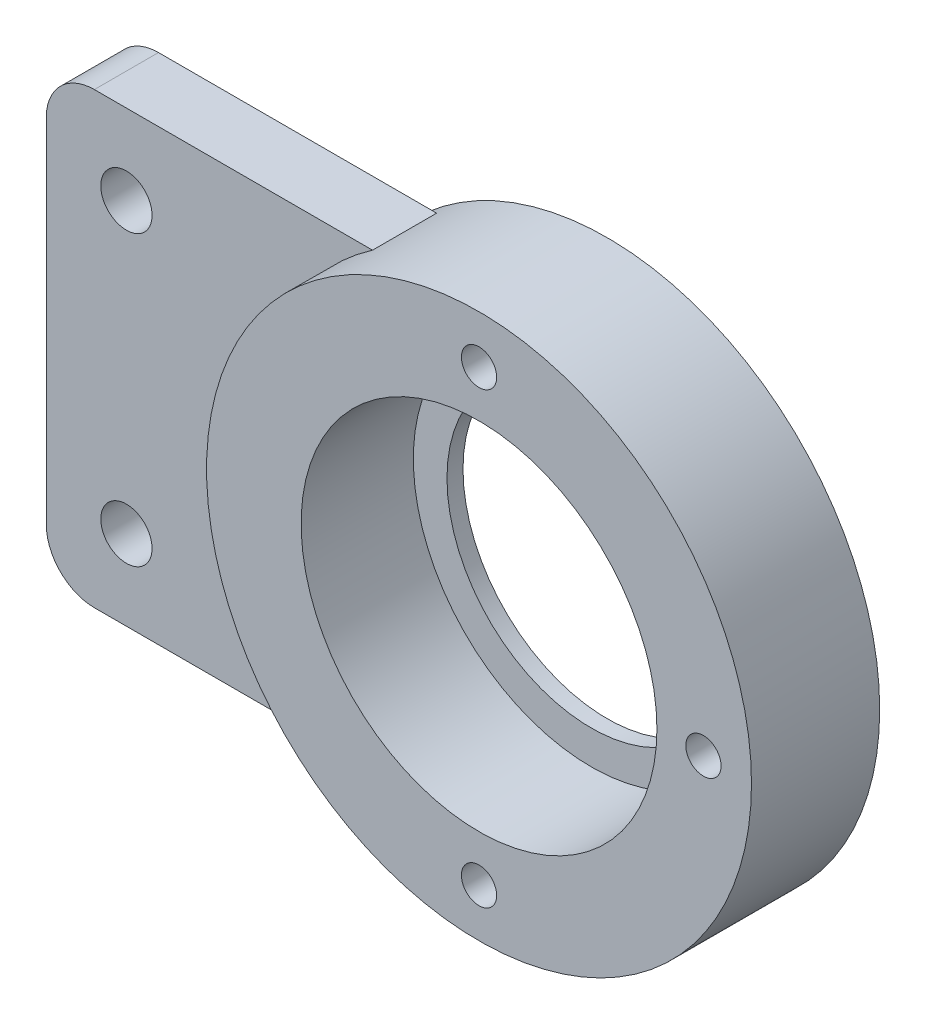
from build123d import *

# Parameters (mm, degrees)
BEARING_HOUSING_PROFILE_R                  = 17
BEARING_HOUSING_PROFILE_R_2                = 11.1
BEARING_HOUSING_DEPTH                      = 7
MOUNTING_WEB_PROFILE_W                     = 30
MOUNTING_WEB_PROFILE_H                     = 28
MOUNTING_WEB_DEPTH                         = 4
BEARING_SEAT_START                         = -50
BEARING_SEAT_PROFILE_R                     = 11.1
BEARING_SEAT_DEPTH                         = 86.185224172
INNER_OUTER_RACE_RETAINING_LIP_START       = -1
INNER_OUTER_RACE_RETAINING_LIP_PROFILE_R   = 17
INNER_OUTER_RACE_RETAINING_LIP_PROFILE_R_2 = 9
INNER_OUTER_RACE_RETAINING_LIP_DEPTH       = 1
STANDOFF_FASTENERS_START                   = -50
STANDOFF_FASTENERS_PROFILE_R               = 1.6
STANDOFF_FASTENERS_DEPTH                   = 86.185224172
BEARING_KEEPER_FASTENERS_START             = -50
BEARING_KEEPER_FASTENERS_PROFILE_R         = 1.1
BEARING_KEEPER_FASTENERS_DEPTH             = 86.185224172
FILLET1_R                                  = 3


with BuildPart() as part:
    # Bearing_housing_profile → Bearing_housing (new body)
    with BuildSketch(Plane.XY):
        Circle(BEARING_HOUSING_PROFILE_R)
        Circle(BEARING_HOUSING_PROFILE_R_2, mode=Mode.SUBTRACT)
    extrude(amount=BEARING_HOUSING_DEPTH)

    # Mounting_web_profile → Mounting_web (add)
    with BuildSketch(Plane.XY):
        with Locations((-15, 0)):
            Rectangle(MOUNTING_WEB_PROFILE_W, MOUNTING_WEB_PROFILE_H)
    extrude(amount=MOUNTING_WEB_DEPTH)

    # Bearing_seat_profile → Bearing_seat (cut, through all)
    with BuildSketch(Plane.XY.offset(BEARING_SEAT_START)):
        Circle(BEARING_SEAT_PROFILE_R)
    extrude(amount=BEARING_SEAT_DEPTH, mode=Mode.SUBTRACT)

    # Inner_outer_race_retaining_lip_profile → Inner_outer_race_retaining_lip (add)
    with BuildSketch(Plane.XY.offset(INNER_OUTER_RACE_RETAINING_LIP_START)):
        Circle(INNER_OUTER_RACE_RETAINING_LIP_PROFILE_R)
        Circle(INNER_OUTER_RACE_RETAINING_LIP_PROFILE_R_2, mode=Mode.SUBTRACT)
    extrude(amount=INNER_OUTER_RACE_RETAINING_LIP_DEPTH)

    # Standoff_fasteners_profile → Standoff_fasteners (cut, through all)
    with BuildSketch(Plane.XY.offset(STANDOFF_FASTENERS_START)):
        with Locations(Location((-25, -9, 0), (0, 0, 180))):
            Circle(STANDOFF_FASTENERS_PROFILE_R)
        with Locations(Location((-25, 9, 0), (0, 0, 180))):
            Circle(STANDOFF_FASTENERS_PROFILE_R)
    extrude(amount=STANDOFF_FASTENERS_DEPTH, mode=Mode.SUBTRACT)

    # Bearing_keeper_fasteners_profile → Bearing_keeper_fasteners (cut, through all)
    with BuildSketch(Plane.XY.offset(BEARING_KEEPER_FASTENERS_START)):
        with Locations(Location((14, 0, 0), (0, 0, 180))):
            Circle(BEARING_KEEPER_FASTENERS_PROFILE_R)
        with Locations(Location((0, -14, 0), (0, 0, 180))):
            Circle(BEARING_KEEPER_FASTENERS_PROFILE_R)
        with Locations(Location((0, 14, 0), (0, 0, 180))):
            Circle(BEARING_KEEPER_FASTENERS_PROFILE_R)
    extrude(amount=BEARING_KEEPER_FASTENERS_DEPTH, mode=Mode.SUBTRACT)

    # Fillet1
    fillet1_edges = [part.edges().sort_by_distance(p)[0] for p in [
        (-30, -14, 2),
        (-30, 14, 2),
    ]]
    fillet(fillet1_edges, radius=FILLET1_R)


solid = part.part
